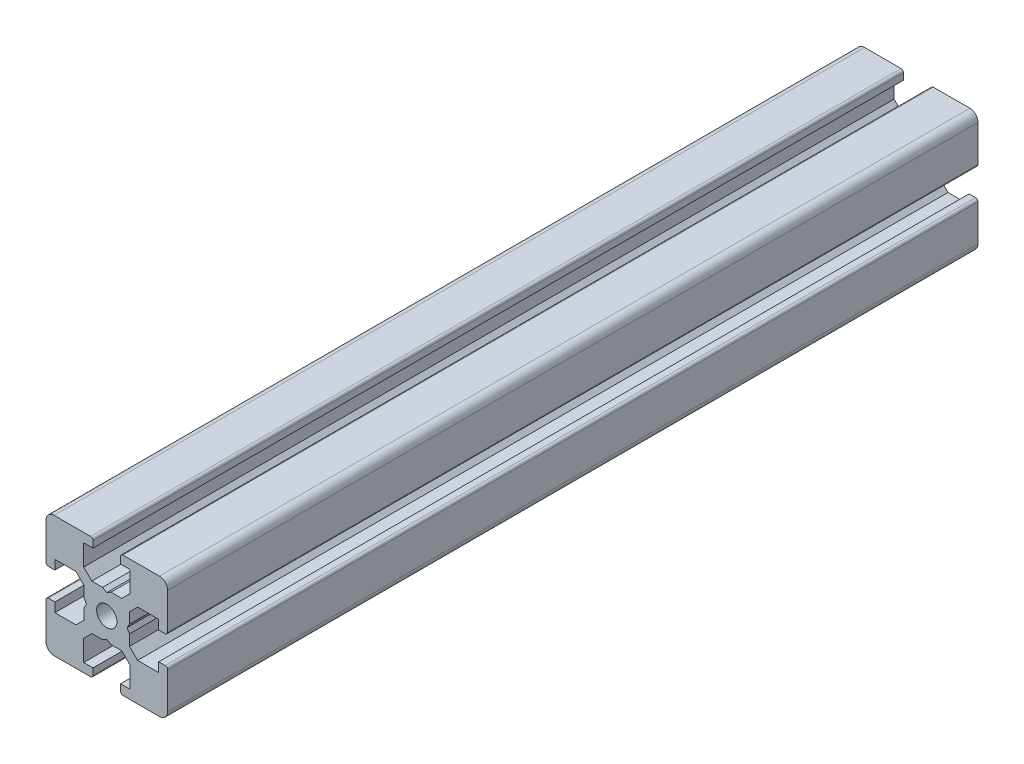
from build123d import *

# Parameters (mm, degrees)
SKETCH1_R           = 1.25
BOSS_EXTRUDE1_DEPTH = 100


with BuildPart() as part:
    # Sketch1 → Boss-Extrude1 (new body)
    with BuildSketch(Plane.XY.offset(115)):
        with BuildLine():
            Line((-7.5, 6.5), (-7.5, 2))
            ThreePointArc((-7.5, 2), (-7.412132034, 1.787867966), (-7.2, 1.7))
            Line((-7.2, 1.7), (-6.4, 1.7))
            Line((-6.4, 1.7), (-6.4, 2.85))
            Line((-6.4, 2.85), (-3.8, 2.85))
            Line((-3.8, 2.85), (-2.8, 1.85))
            Line((-2.8, 1.85), (-2.8, 0.519615242))
            Line((-2.8, 0.519615242), (-2.5, 0))
            Line((-2.5, 0), (-2.8, -0.519615242))
            Line((-2.8, -0.519615242), (-2.8, -1.85))
            Line((-2.8, -1.85), (-3.8, -2.85))
            Line((-3.8, -2.85), (-6.4, -2.85))
            Line((-6.4, -2.85), (-6.4, -1.7))
            Line((-6.4, -1.7), (-7.2, -1.7))
            ThreePointArc((-7.2, -1.7), (-7.412132034, -1.787867966), (-7.5, -2))
            Line((-7.5, -2), (-7.5, -6.5))
            ThreePointArc((-7.5, -6.5), (-7.207106781, -7.207106781), (-6.5, -7.5))
            Line((-6.5, -7.5), (-2, -7.5))
            ThreePointArc((-2, -7.5), (-1.787867966, -7.412132034), (-1.7, -7.2))
            Line((-1.7, -7.2), (-1.7, -6.4))
            Line((-1.7, -6.4), (-2.85, -6.4))
            Line((-2.85, -6.4), (-2.85, -3.8))
            Line((-2.85, -3.8), (-1.85, -2.8))
            Line((-1.85, -2.8), (-0.519615242, -2.8))
            Line((-0.519615242, -2.8), (0, -2.5))
            Line((0, -2.5), (0.519615242, -2.8))
            Line((0.519615242, -2.8), (1.85, -2.8))
            Line((1.85, -2.8), (2.85, -3.8))
            Line((2.85, -3.8), (2.85, -6.4))
            Line((2.85, -6.4), (1.7, -6.4))
            Line((1.7, -6.4), (1.7, -7.2))
            ThreePointArc((1.7, -7.2), (1.787867966, -7.412132034), (2, -7.5))
            Line((2, -7.5), (6.5, -7.5))
            ThreePointArc((6.5, -7.5), (7.207106781, -7.207106781), (7.5, -6.5))
            Line((7.5, -6.5), (7.5, -2))
            ThreePointArc((7.5, -2), (7.412132034, -1.787867966), (7.2, -1.7))
            Line((7.2, -1.7), (6.4, -1.7))
            Line((6.4, -1.7), (6.4, -2.85))
            Line((6.4, -2.85), (3.8, -2.85))
            Line((3.8, -2.85), (2.8, -1.85))
            Line((2.8, -1.85), (2.8, -0.519615242))
            Line((2.8, -0.519615242), (2.5, 0))
            Line((2.5, 0), (2.8, 0.519615242))
            Line((2.8, 0.519615242), (2.8, 1.85))
            Line((2.8, 1.85), (3.8, 2.85))
            Line((3.8, 2.85), (6.4, 2.85))
            Line((6.4, 2.85), (6.4, 1.7))
            Line((6.4, 1.7), (7.2, 1.7))
            ThreePointArc((7.2, 1.7), (7.412132034, 1.787867966), (7.5, 2))
            Line((7.5, 2), (7.5, 6.5))
            ThreePointArc((7.5, 6.5), (7.207106781, 7.207106781), (6.5, 7.5))
            Line((6.5, 7.5), (2, 7.5))
            ThreePointArc((2, 7.5), (1.787867966, 7.412132034), (1.7, 7.2))
            Line((1.7, 7.2), (1.7, 6.4))
            Line((1.7, 6.4), (2.85, 6.4))
            Line((2.85, 6.4), (2.85, 3.8))
            Line((2.85, 3.8), (1.85, 2.8))
            Line((1.85, 2.8), (0.519615242, 2.8))
            Line((0.519615242, 2.8), (0, 2.5))
            Line((0, 2.5), (-0.519615242, 2.8))
            Line((-0.519615242, 2.8), (-1.85, 2.8))
            Line((-1.85, 2.8), (-2.85, 3.8))
            Line((-2.85, 3.8), (-2.85, 6.4))
            Line((-2.85, 6.4), (-1.7, 6.4))
            Line((-1.7, 6.4), (-1.7, 7.2))
            ThreePointArc((-1.7, 7.2), (-1.787867966, 7.412132034), (-2, 7.5))
            Line((-2, 7.5), (-6.5, 7.5))
            ThreePointArc((-6.5, 7.5), (-7.207106781, 7.207106781), (-7.5, 6.5))
        make_face()
        with Locations(Location((0, 0, 0), (0, 0, 180))):
            Circle(SKETCH1_R, mode=Mode.SUBTRACT)
    extrude(amount=-BOSS_EXTRUDE1_DEPTH)


solid = part.part
